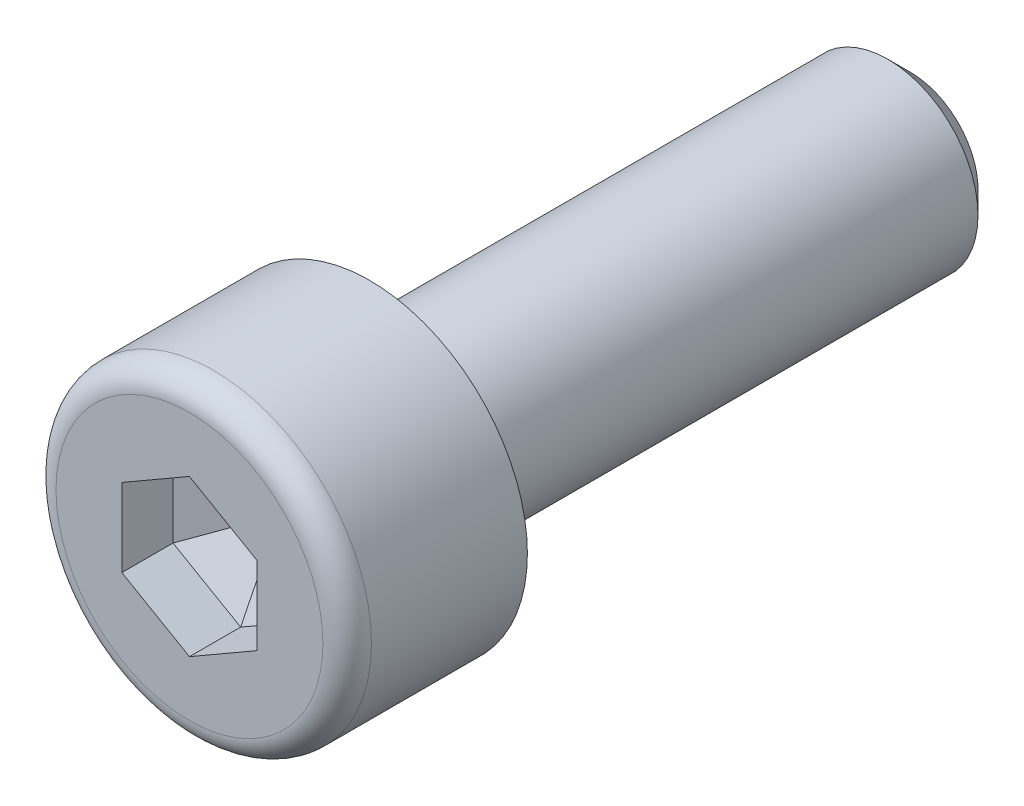
from build123d import *
from OCP.BRepFilletAPI import BRepFilletAPI_MakeChamfer

# Parameters (mm, degrees)
SKETCH_1_R          = 3.5
EXTRUDE_1_DEPTH     = 4
CUT_EXTRUDE_1_DEPTH = 2
SKETCH_3_R          = 2
EXTRUDE_2_DEPTH     = 12
CHAMFER_1_SIZE      = 0.5
FILLET_1_R          = 0.538461538
CHAMFER_2_SIZE      = 0.864553314
CHAMFER_2_SIZE2     = 1.497450266
FILLET_2_R          = 0.1


with BuildPart() as part:
    # 草图1 → 凸台-拉伸1 (new body)
    with BuildSketch(Plane.XY):
        Circle(SKETCH_1_R)
    extrude(amount=EXTRUDE_1_DEPTH)

    # 草图2 → 切除-拉伸1 (cut)
    with BuildSketch(Plane.XY.offset(4)):
        Polygon((1.5, 0.866025404), (0, 1.732050808), (-1.5, 0.866025404), (-1.5, -0.866025404), (0, -1.732050808), (1.5, -0.866025404), align=None)
    extrude(amount=-CUT_EXTRUDE_1_DEPTH, mode=Mode.SUBTRACT)

    # 草图3 → 凸台-拉伸2 (add)
    with BuildSketch(Plane(origin=(0, 0, 0), x_dir=(-1, 0, 0), z_dir=(0, 0, -1))):
        Circle(SKETCH_3_R)
    extrude(amount=EXTRUDE_2_DEPTH)

    # 倒角1
    chamfer_1_edges = [part.edges().sort_by_distance(p)[0] for p in [
        (2, 0, -12),
    ]]
    chamfer(chamfer_1_edges, length=CHAMFER_1_SIZE)

    # 圆角1
    fillet_1_edges = [part.edges().sort_by_distance(p)[0] for p in [
        (-3.5, 0, 4),
    ]]
    fillet(fillet_1_edges, radius=FILLET_1_R)

    # 倒角2: one chamfer whose edges measure the first distance from different faces: ONE call of the kernel's chamfer builder (chamfer() names one face for all edges)
    chamfer_2_edges_1 = [part.edges().sort_by_distance(p)[0] for p in [
        (-1.5, 0, 2),
    ]]
    chamfer_2_side_1 = [part.faces().sort_by_distance(p)[0] for p in [
        (-1.5, 0, 3),
    ]]
    chamfer_2_edges_2 = [part.edges().sort_by_distance(p)[0] for p in [
        (-0.75, 1.299038106, 2),
    ]]
    chamfer_2_side_2 = [part.faces().sort_by_distance(p)[0] for p in [
        (-0.75, 1.299038106, 3),
    ]]
    chamfer_2_edges_3 = [part.edges().sort_by_distance(p)[0] for p in [
        (0.75, 1.299038106, 2),
    ]]
    chamfer_2_side_3 = [part.faces().sort_by_distance(p)[0] for p in [
        (0.75, 1.299038106, 3),
    ]]
    chamfer_2_edges_4 = [part.edges().sort_by_distance(p)[0] for p in [
        (1.5, 0, 2),
    ]]
    chamfer_2_side_4 = [part.faces().sort_by_distance(p)[0] for p in [
        (1.5, 0, 3),
    ]]
    chamfer_2_edges_5 = [part.edges().sort_by_distance(p)[0] for p in [
        (-0.75, -1.299038106, 2),
    ]]
    chamfer_2_side_5 = [part.faces().sort_by_distance(p)[0] for p in [
        (-0.75, -1.299038106, 3),
    ]]
    chamfer_2_edges_6 = [part.edges().sort_by_distance(p)[0] for p in [
        (0.75, -1.299038106, 2),
    ]]
    chamfer_2_side_6 = [part.faces().sort_by_distance(p)[0] for p in [
        (0.75, -1.299038106, 3),
    ]]
    chamfer_2 = BRepFilletAPI_MakeChamfer(part.part.solid().wrapped)
    for e in chamfer_2_edges_1:
        chamfer_2.Add(CHAMFER_2_SIZE, CHAMFER_2_SIZE2, e.wrapped, chamfer_2_side_1[0].wrapped)  # the first distance lies on this face
    for e in chamfer_2_edges_2:
        chamfer_2.Add(CHAMFER_2_SIZE, CHAMFER_2_SIZE2, e.wrapped, chamfer_2_side_2[0].wrapped)  # the first distance lies on this face
    for e in chamfer_2_edges_3:
        chamfer_2.Add(CHAMFER_2_SIZE, CHAMFER_2_SIZE2, e.wrapped, chamfer_2_side_3[0].wrapped)  # the first distance lies on this face
    for e in chamfer_2_edges_4:
        chamfer_2.Add(CHAMFER_2_SIZE, CHAMFER_2_SIZE2, e.wrapped, chamfer_2_side_4[0].wrapped)  # the first distance lies on this face
    for e in chamfer_2_edges_5:
        chamfer_2.Add(CHAMFER_2_SIZE, CHAMFER_2_SIZE2, e.wrapped, chamfer_2_side_5[0].wrapped)  # the first distance lies on this face
    for e in chamfer_2_edges_6:
        chamfer_2.Add(CHAMFER_2_SIZE, CHAMFER_2_SIZE2, e.wrapped, chamfer_2_side_6[0].wrapped)  # the first distance lies on this face
    add(Compound.cast(chamfer_2.Shape()), mode=Mode.REPLACE)

    # 圆角2
    fillet_2_edges = [part.edges().sort_by_distance(p)[0] for p in [
        (2, 0, 0),
    ]]
    fillet(fillet_2_edges, radius=FILLET_2_R)


solid = part.part
